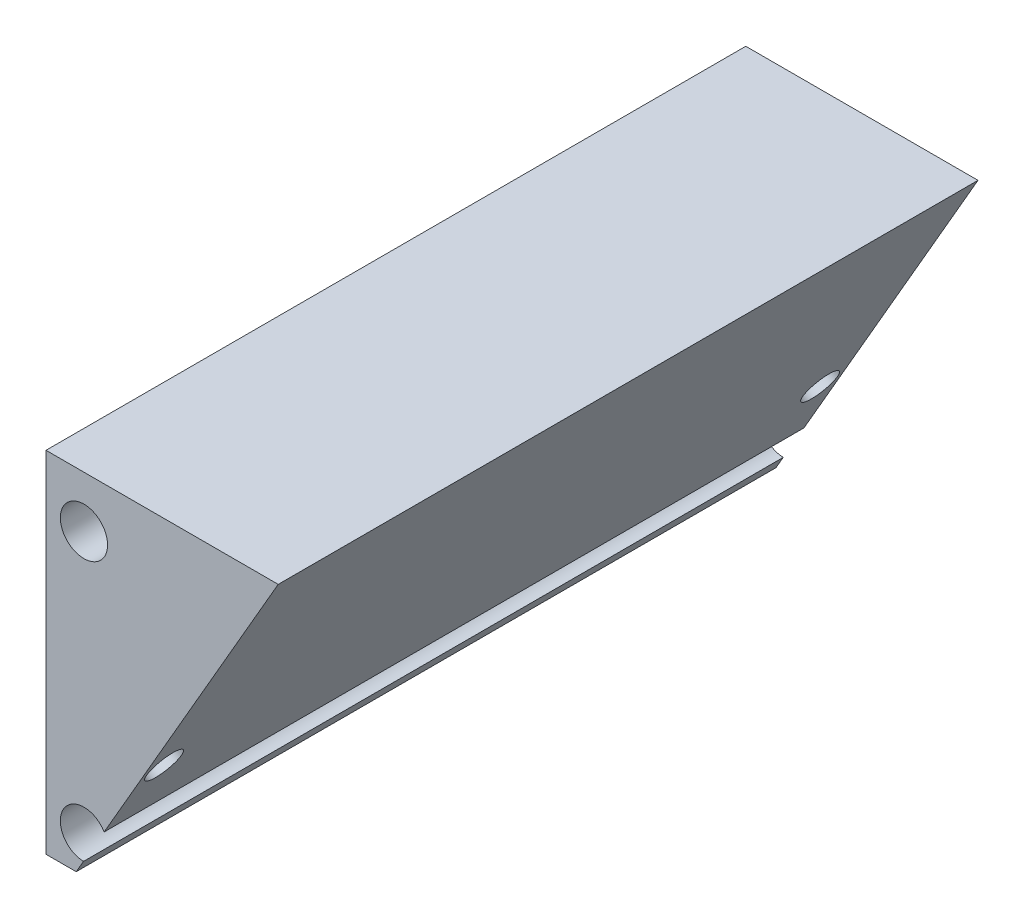
from build123d import *

# Parameters (mm, degrees)
SKETCH_1_R          = 1.35
EXTRUDE_1_DEPTH     = 40
SKETCH_2_R          = 1
CUT_EXTRUDE_1_DEPTH = 40


with BuildPart() as part:
    # 草图1 → 凸台-拉伸1 (new body)
    with BuildSketch(Plane.XY):
        with BuildLine():
            Line((0, 0), (5.773502692, 10))
            Line((5.773502692, 10), (-7.5, 10))
            Line((-7.5, 10), (-7.5, -10))
            Line((-7.5, -10), (-5.773502692, -10))
            Line((-5.773502692, -10), (-5.357205868, -9.278952749))
            ThreePointArc((-5.357205868, -9.278952749), (-6.499558695, -7.254218423), (-4.174910918, -7.231157828))
            Line((-4.174910918, -7.231157828), (0, 0))
        make_face()
        with Locations((-5.3304244, 7.070781577)):
            Circle(SKETCH_1_R, mode=Mode.SUBTRACT)
    extrude(amount=EXTRUDE_1_DEPTH)

    # 草图2 → 切除-拉伸1 (cut)
    with BuildSketch(Plane(origin=(0, 0, 0), x_dir=(0, 0, -1), z_dir=(0.8660254037844399, -0.4999999999999977, 0))):
        with Locations(Location((-1.25, -4, 0), (0, 0, 90))):
            Circle(SKETCH_2_R)
        with Locations(Location((-38.75, -4, 0), (0, 0, 90))):
            Circle(SKETCH_2_R)
    extrude(amount=-CUT_EXTRUDE_1_DEPTH, mode=Mode.SUBTRACT)


solid = part.part
